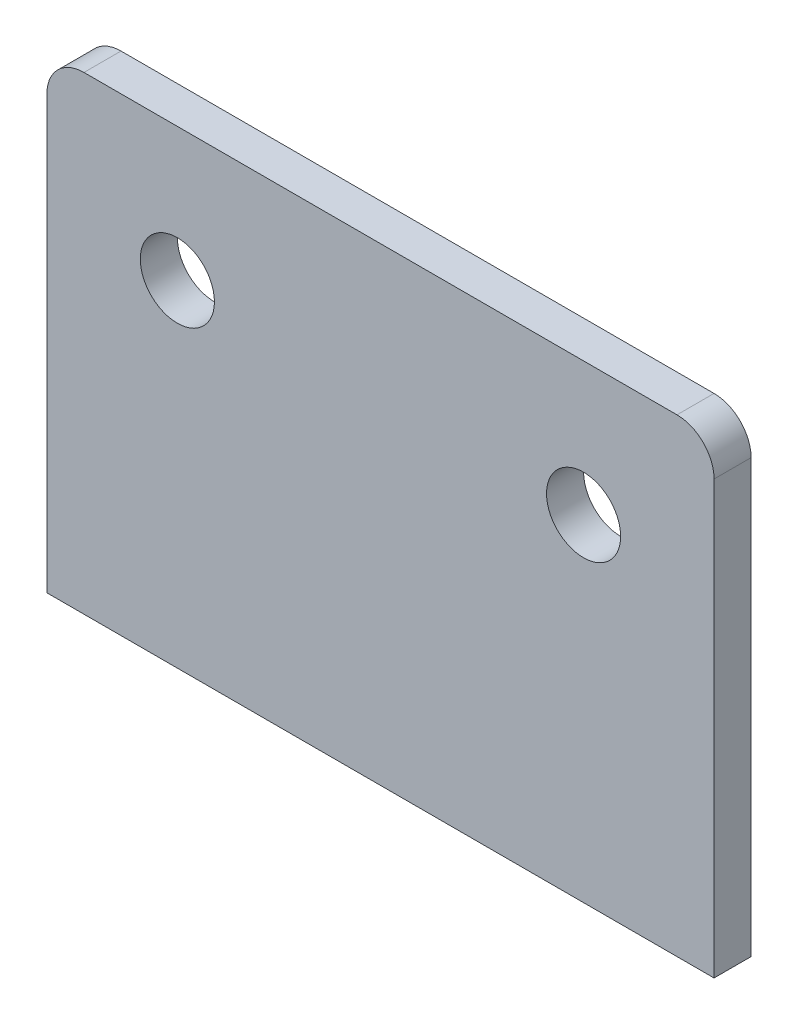
from build123d import *

# Parameters (mm, degrees)
BOSS_EXTRUDE1_DEPTH = 3.175
SKETCH2_R           = 3.175
CUT_EXTRUDE1_DEPTH  = 67.929307933
SKETCH3_W           = 57.15
SKETCH3_H           = 29.175717927
CUT_EXTRUDE2_DEPTH  = 5.08


with BuildPart() as part:
    # Sketch1 → Boss-Extrude1 (new body)
    with BuildSketch(Plane.XY):
        with BuildLine():
            Line((-28.328951223, 3.070773738), (-28.328951223, -34.922456704))
            Line((-28.328951223, -34.922456704), (-28.328951223, -57.147456704))
            ThreePointArc((-28.328951223, -57.147456704), (-27.399015253, -59.392520734), (-25.153951223, -60.322456704))
            Line((-25.153951223, -60.322456704), (25.646048777, -60.322456704))
            ThreePointArc((25.646048777, -60.322456704), (27.891112807, -59.392520734), (28.821048777, -57.147456704))
            Line((28.821048777, -57.147456704), (28.821048777, -34.922456704))
            Line((28.821048777, -34.922456704), (28.821048777, 3.070773738))
            ThreePointArc((28.821048777, 3.070773738), (27.891112807, 5.315837768), (25.646048777, 6.245773738))
            Line((25.646048777, 6.245773738), (-25.153951223, 6.245773738))
            ThreePointArc((-25.153951223, 6.245773738), (-27.399015253, 5.315837768), (-28.328951223, 3.070773738))
        make_face()
    extrude(amount=-BOSS_EXTRUDE1_DEPTH)

    # Sketch2 → Cut-Extrude1 (cut, through all)
    with BuildSketch(Plane.XY):
        with Locations((-17.152951223, -5.184226262)):
            Circle(SKETCH2_R)
        with Locations(Location((17.645048777, -5.184226262, 0), (0, 0, 180))):
            Circle(SKETCH2_R)
    extrude(amount=-CUT_EXTRUDE1_DEPTH, mode=Mode.SUBTRACT)

    # Sketch3 → Cut-Extrude2 (cut)
    with BuildSketch(Plane(origin=(0, 0, -3.175), x_dir=(-1, 0, 0), z_dir=(0, 0, -1))):
        with Locations((-0.246048777, -48.534555274)):
            Rectangle(SKETCH3_W, SKETCH3_H)
    extrude(amount=-CUT_EXTRUDE2_DEPTH, mode=Mode.SUBTRACT)


solid = part.part
